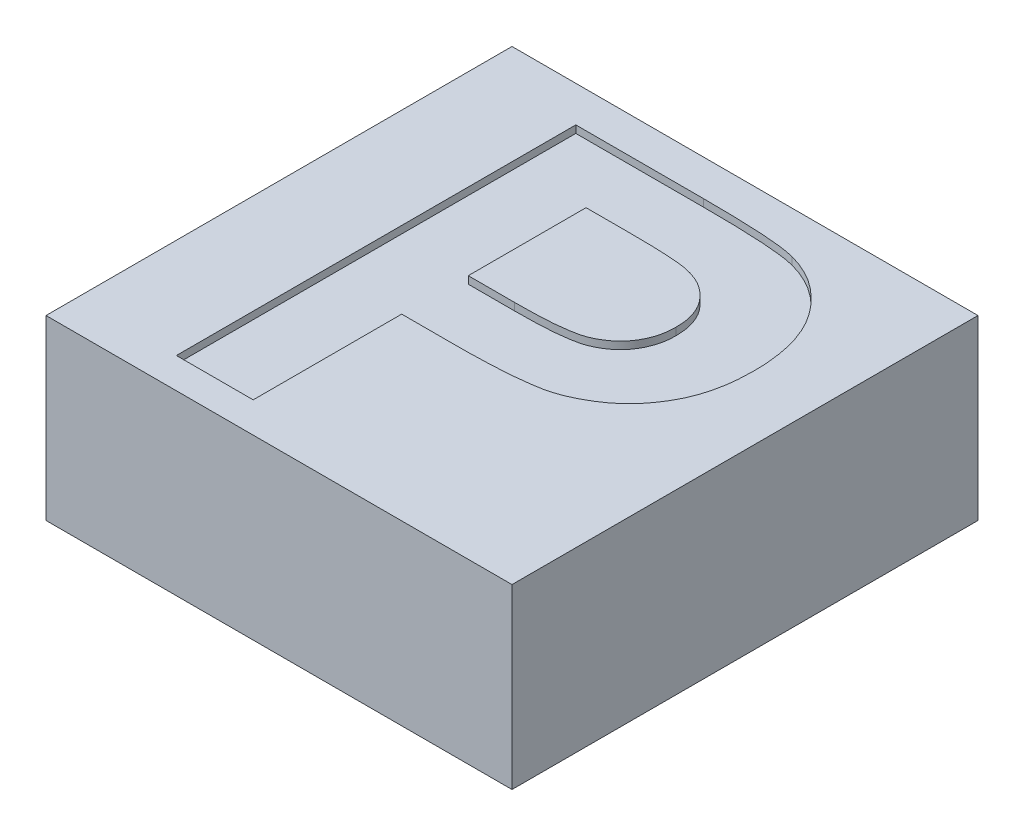
from build123d import *

# Parameters (mm, degrees)
SKETCH1_W           = 31.5
SKETCH1_H           = 31.5
BOSS_EXTRUDE1_DEPTH = 12
CUT_EXTRUDE1_DEPTH  = 0.5


with BuildPart() as part:
    # Sketch1 → Boss-Extrude1 (new body)
    with BuildSketch(Plane(origin=(0, 0, 0), x_dir=(1, 0, 0), z_dir=(0, 1, 0))):
        with Locations((15.75, 15.75)):
            Rectangle(SKETCH1_W, SKETCH1_H)
    extrude(amount=BOSS_EXTRUDE1_DEPTH)

    # Sketch2 → Cut-Extrude1 (cut)
    with BuildSketch(Plane(origin=(0, 12, 0), x_dir=(1, 0, 0), z_dir=(0, 1, 0))):
        with BuildLine():
            Line((6.747621019, 2.065503665), (6.747621019, 29.065503665))
            Line((6.747621019, 29.065503665), (15.385241211, 29.065503665))
            add(Edge.make_bspline(
                [(15.385241211, 29.065503665), (15.776479961, 29.065076414), (16.524770581, 29.064259246), (17.592161888, 29.041554875), (18.553187847, 29.009414336), (19.406422141, 28.969384655), (20.154867078, 28.909652682), (20.795165219, 28.840483957), (21.331348478, 28.766076764), (21.647090916, 28.68907527), (21.789087365, 28.654445973)],
                knots=[0, 0, 0, 0, 1.460485487, 2.793352117, 3.985295279, 5.050041172, 5.981765236, 6.787433016, 7.454681457, 8, 8, 8, 8], degree=3))
            add(Edge.make_bspline(
                [(21.789087365, 28.654445973), (21.977908112, 28.600605902), (22.352673057, 28.493745974), (22.889594358, 28.265937582), (23.40710147, 28.001919809), (23.898692472, 27.687258347), (24.366038435, 27.327539547), (24.810528525, 26.925696963), (25.234533144, 26.479916594), (25.632186734, 25.991079052), (25.996390644, 25.461649309), (26.311154328, 24.890844616), (26.574860483, 24.281145984), (26.799533744, 23.63713522), (26.965298747, 22.951907486), (27.081304113, 22.230223822), (27.162058322, 21.471768579), (27.16777597, 20.952743669), (27.170697942, 20.687498858)],
                knots=[0, 0, 0, 0, 0.907145743, 1.80047177, 2.69161667, 3.591261238, 4.495029544, 5.415863088, 6.359363025, 7.337192411, 8.326890979, 9.326929023, 10.346104993, 11.395420813, 12.477187422, 13.601053412, 14.774031606, 16, 16, 16, 16], degree=3))
            add(Edge.make_bspline(
                [(27.170697942, 20.687498858), (27.162364492, 20.284694456), (27.146322143, 19.509273864), (26.966836725, 18.397614462), (26.693077309, 17.382185261), (26.292958142, 16.472766953), (25.805129757, 15.665790828), (25.267776748, 14.938305662), (24.654198579, 14.312238597), (23.991281493, 13.777486058), (23.290699292, 13.339866766), (22.588848894, 12.966802533), (21.876259855, 12.67997883), (21.390418234, 12.555007436), (21.150866211, 12.493388281)],
                knots=[0, 0, 0, 0, 1.312386234, 2.526415563, 3.661883817, 4.733421185, 5.753802465, 6.732107337, 7.675884281, 8.604170108, 9.50284679, 10.365392406, 11.194030444, 12, 12, 12, 12], degree=3))
            add(Edge.make_bspline(
                [(21.150866211, 12.493388281), (20.979885726, 12.460863774), (20.619479264, 12.392305995), (20.047896175, 12.323966368), (19.423124881, 12.24832185), (18.742595655, 12.198982246), (18.007131761, 12.152777775), (17.217018782, 12.130963119), (16.373385874, 12.104680889), (15.792719174, 12.10420863), (15.493414288, 12.103965204)],
                knots=[0, 0, 0, 0, 0.735353946, 1.55003838, 2.431865514, 3.394945452, 4.432993119, 5.54609699, 6.735134699, 8, 8, 8, 8], degree=3))
            Line((15.493414288, 12.103965204), (11.939928711, 12.103965204))
            Line((11.939928711, 12.103965204), (11.939928711, 2.065503665))
            Line((11.939928711, 2.065503665), (6.747621019, 2.065503665))
        make_face()
        with BuildLine():
            Line((11.939928711, 24.565503665), (11.939928711, 16.603965204))
            Line((11.939928711, 16.603965204), (15.055313327, 16.603965204))
            add(Edge.make_bspline(
                [(15.055313327, 16.603965204), (15.323966729, 16.604313087), (15.837934489, 16.604978632), (16.575364214, 16.628867789), (17.242886299, 16.658028936), (17.841895509, 16.7062966), (18.368776067, 16.769912227), (18.827056361, 16.846004529), (19.217270507, 16.927659519), (19.639233984, 17.062974924), (20.090397304, 17.281902908), (20.572186709, 17.596557411), (20.995438133, 17.97276398), (21.347639417, 18.414605566), (21.628970266, 18.905517169), (21.830403359, 19.440467762), (21.960468518, 20.010591345), (21.972348784, 20.405530729), (21.97839025, 20.60636905)],
                knots=[0, 0, 0, 0, 1.411705958, 2.700771114, 3.876961699, 4.922619712, 5.858038221, 6.66485904, 7.363650596, 7.950905807, 8.989198271, 9.987739806, 10.967313358, 11.951275539, 12.944273208, 13.927870418, 14.946261014, 16, 16, 16, 16], degree=3))
            add(Edge.make_bspline(
                [(21.97839025, 20.60636905), (21.969887549, 20.850986989), (21.953401934, 21.32526892), (21.77161162, 22.000725543), (21.491129938, 22.613710617), (21.090120764, 23.14515141), (20.605711119, 23.592049413), (20.061254895, 23.963884441), (19.445124983, 24.224097423), (19.009070151, 24.324920349), (18.787284481, 24.376200781)],
                knots=[0, 0, 0, 0, 1.085904563, 2.105425768, 3.088705091, 4.068969419, 5.045188284, 6.010769642, 6.988240112, 8, 8, 8, 8], degree=3))
            add(Edge.make_bspline(
                [(18.787284481, 24.376200781), (18.69184504, 24.391465541), (18.479999071, 24.425348577), (18.127867959, 24.460709738), (17.711296797, 24.492870678), (17.229783451, 24.519275772), (16.685236518, 24.53991844), (16.075859838, 24.558006509), (15.40325832, 24.559459645), (14.932712769, 24.563433173), (14.687524865, 24.565503665)],
                knots=[0, 0, 0, 0, 0.564603001, 1.253243608, 2.066786758, 3.005752288, 4.070476343, 5.250658742, 6.567396469, 8, 8, 8, 8], degree=3))
            Line((14.687524865, 24.565503665), (11.939928711, 24.565503665))
        make_face(mode=Mode.SUBTRACT)
    extrude(amount=-CUT_EXTRUDE1_DEPTH, mode=Mode.SUBTRACT)


solid = part.part
